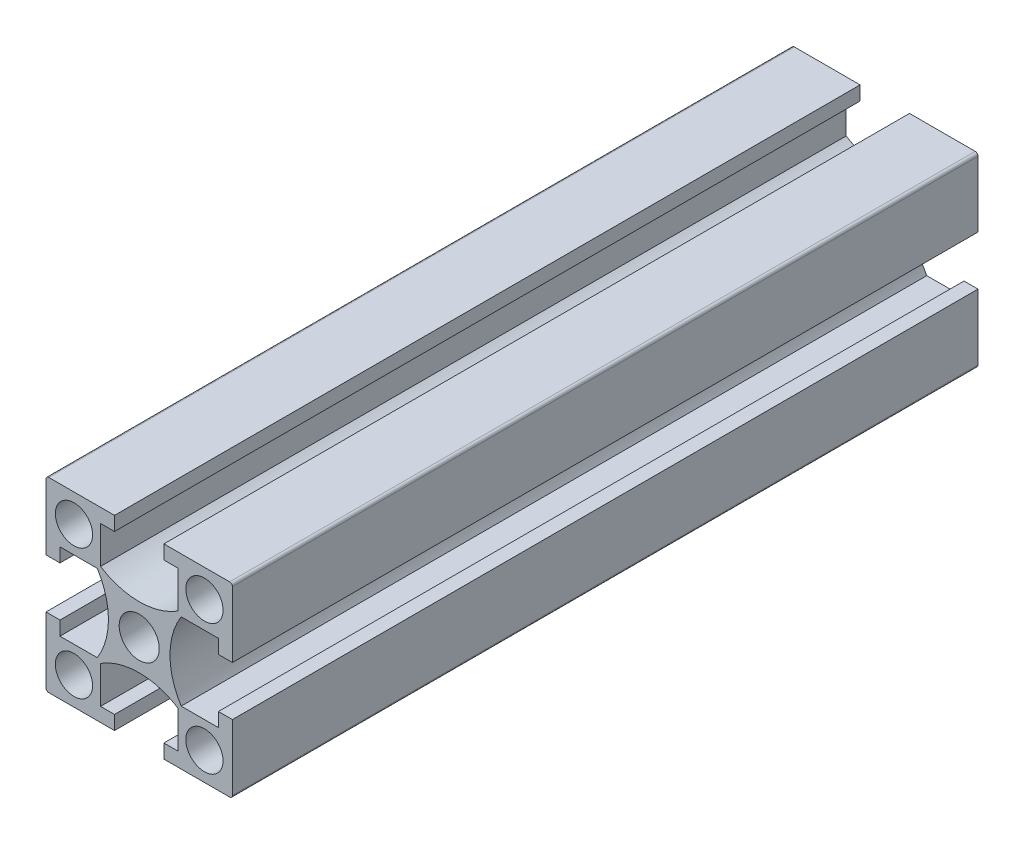
from build123d import *

# Parameters (mm, degrees)
SKETCH_1_W               = 20
SKETCH_1_H               = 20
SKETCH_1_R               = 2
SKETCH_1_R_2             = 2.15
EXTRUDE_1_DEPTH          = 80
CUT_EXTRUDE_1_REACH      = 83.24
PATTERN_CIRCULAR_1_COUNT = 4
FILLET_1_R               = 0.3
SKETCH_3_R               = 2.5
CUT_EXTRUDE_2_DEPTH      = 84.066238629


with BuildPart() as part:
    # 스케치1 → 보스-돌출1 (new body)
    with BuildSketch(Plane.XY):
        Rectangle(SKETCH_1_W, SKETCH_1_H)
        with Locations((-7, -7)):
            Circle(SKETCH_1_R, mode=Mode.SUBTRACT)
        with Locations((7, -7)):
            Circle(SKETCH_1_R, mode=Mode.SUBTRACT)
        with Locations((-7, 7)):
            Circle(SKETCH_1_R, mode=Mode.SUBTRACT)
        Circle(SKETCH_1_R_2, mode=Mode.SUBTRACT)
        with Locations((7, 7)):
            Circle(SKETCH_1_R, mode=Mode.SUBTRACT)
    extrude(amount=EXTRUDE_1_DEPTH)

    # 스케치1<3> → 컷-돌출1 (cut, up to next)
    with BuildSketch(Plane.XY, mode=Mode.PRIVATE) as cut_extrude_1_sk1:
        with BuildLine():
            Line((-8.5, 2.65), (-10, 2.65))
            Line((-10, 2.65), (-10, -2.65))
            Line((-10, -2.65), (-8.5, -2.65))
            Line((-8.5, -2.65), (-8.5, -4.15))
            Line((-8.5, -4.15), (-4.503166667, -4.15))
            ThreePointArc((-4.503166667, -4.15), (-3.3, 0), (-4.503166667, 4.15))
            Line((-4.503166667, 4.15), (-8.5, 4.15))
            Line((-8.5, 4.15), (-8.5, 2.65))
        make_face()
    cut_extrude_1_tool1 = extrude(cut_extrude_1_sk1.sketch, amount=CUT_EXTRUDE_1_REACH, mode=Mode.PRIVATE) & part.part
    cut_extrude_1 = cut_extrude_1_tool1.solids().sort_by_distance((-6.606913, 0, 0))[0]
    add(cut_extrude_1, mode=Mode.SUBTRACT)

    # 원형 패턴1: 컷-돌출1 ×4 about axis
    pattern_circular_1_axis = Axis((0, 0, 80), (0, 0, -1))
    for i in range(1, PATTERN_CIRCULAR_1_COUNT):
        add(cut_extrude_1.rotate(pattern_circular_1_axis, i * 360 / PATTERN_CIRCULAR_1_COUNT), mode=Mode.SUBTRACT)

    # 필렛1
    fillet_1_edges = [part.edges().sort_by_distance(p)[0] for p in [
        (10, -10, 40),
        (-10, -10, 40),
        (-10, 10, 40),
        (10, 10, 40),
    ]]
    fillet(fillet_1_edges, radius=FILLET_1_R)

    # 스케치3 → 컷-돌출2 (cut, through all)
    with BuildSketch(Plane.XZ.offset(10)):
        with Locations((0, 69)):
            Circle(SKETCH_3_R)
        with Locations((0, 11)):
            Circle(SKETCH_3_R)
    extrude(amount=-CUT_EXTRUDE_2_DEPTH, mode=Mode.SUBTRACT)


solid = part.part
